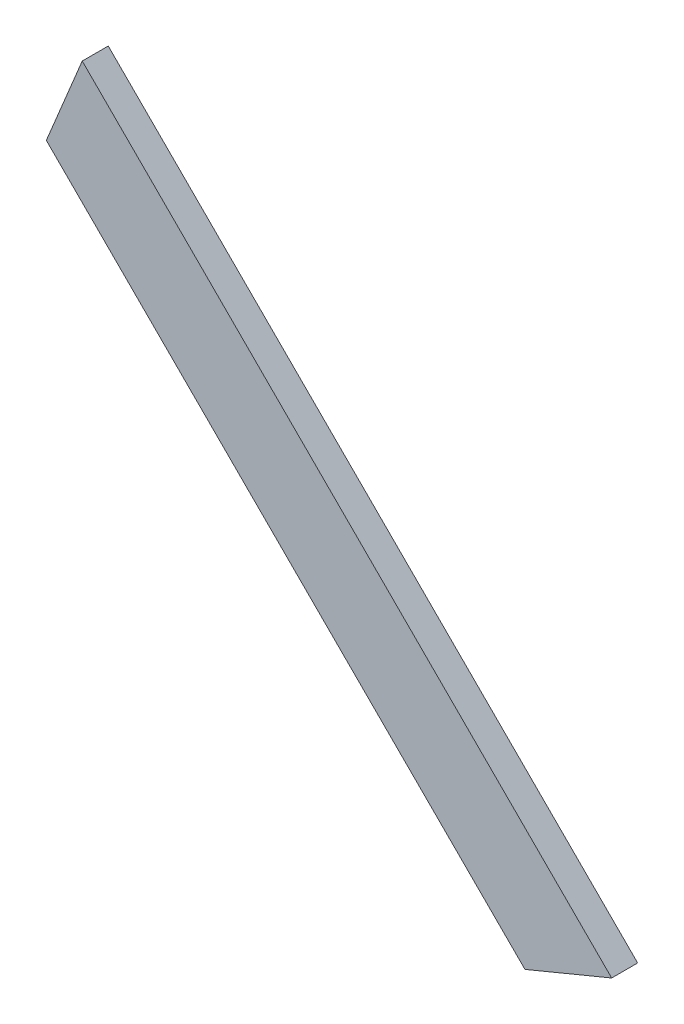
from build123d import *

# Parameters (mm, degrees)
BOSS_EXTRUDE1_DEPTH = 19.05


with BuildPart() as part:
    # Sketch3 → Boss-Extrude1 (new body)
    with BuildSketch(Plane.XY):
        Polygon((-528.085778855, 1843.946787186), (-140.28449825, 1456.145506581), (-203.78449825, 1429.84294537), (-554.388340066, 1780.446787186), align=None)
    extrude(amount=BOSS_EXTRUDE1_DEPTH)


solid = part.part
